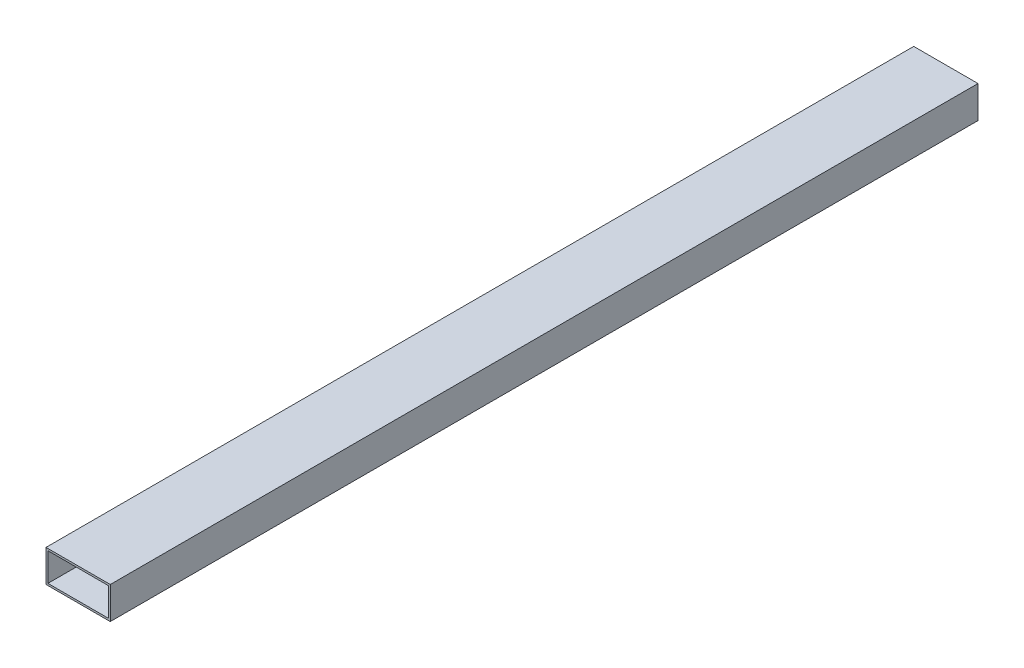
from build123d import *

# Parameters (mm, degrees)
SKETCH2_W           = 50.8
SKETCH2_H           = 25.4
SKETCH2_W_2         = 47.752
SKETCH2_H_2         = 22.352
EXTRUDE_THIN1_DEPTH = 685.8


with BuildPart() as part:
    # Sketch2 → Extrude-Thin1 (new body)
    with BuildSketch(Plane.XY):
        with Locations((-25.4, 12.7)):
            Rectangle(SKETCH2_W, SKETCH2_H)
        with Locations((-25.4, 12.7)):
            Rectangle(SKETCH2_W_2, SKETCH2_H_2, mode=Mode.SUBTRACT)
    extrude(amount=EXTRUDE_THIN1_DEPTH)


solid = part.part
